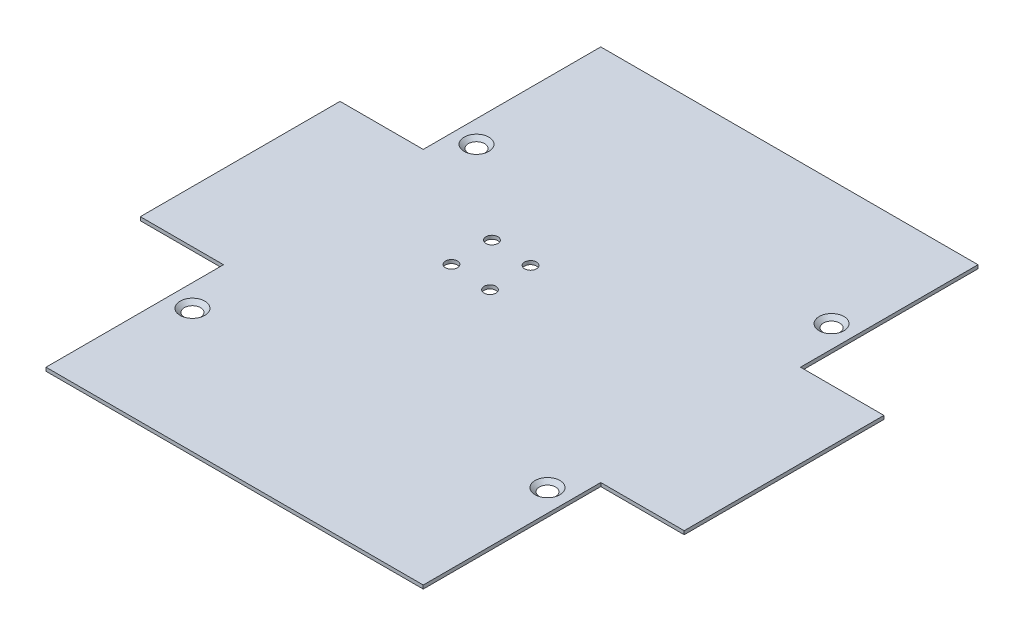
from build123d import *

# Parameters (mm, degrees)
BOSS_EXTRUDE1_DEPTH                       = 1.016
CSK_FOR_6_FLAT_HEAD_MACHINE_SCREW_2_COUNT = 2
CSK_FOR_6_FLAT_HEAD_MACHINE_SCREW_2_PITCH = 95.461432003
CSK_FOR_6_FLAT_HEAD_MACHINE_SCREW_3_COUNT = 2
CSK_FOR_6_FLAT_HEAD_MACHINE_SCREW_3_PITCH = 121.190211651
CSK_FOR_6_FLAT_HEAD_MACHINE_SCREW_4_COUNT = 2
CSK_FOR_6_FLAT_HEAD_MACHINE_SCREW_4_PITCH = 81.28
M3_CLEARANCE_HOLE1_D                      = 3.4
M3_CLEARANCE_HOLE1_DEPTH                  = 20.066
M3_CLEARANCE_HOLE1_TIP                    = 1.021463052


with BuildPart() as part:
    # Sketch1 → Boss-Extrude1 (new body)
    with BuildSketch(Plane(origin=(0, 0, 0), x_dir=(1, 0, 0), z_dir=(0, 1, 0))):
        Polygon((-107.95, 50.8), (-131.7625, 50.8), (-131.7625, 107.95), (-107.95, 107.95), (-107.95, 158.75), (0, 158.75), (0, 107.95), (23.876, 107.95), (23.876, 50.8), (0, 50.8), (0, 0), (-107.95, 0), align=None)
    extrude(amount=BOSS_EXTRUDE1_DEPTH)

    # Sketch2 → CSK for #6 Flat Head Machine Screw (100)1 (revolve, cut)
    with BuildSketch(Plane(origin=(-101.6, 1.016, -116.84), x_dir=(0, 0, 1), z_dir=(1, 0, 0))):
        Polygon((0, 0), (0, 1.016), (1.89865, 1.016), (1.89865, 1.380025208), (3.5433, 0), align=None)
    csk_for_6_flat_head_machine_screw_100 = revolve(axis=Axis((-101.6, 7.366, -116.84), (0, -1, 0)), mode=Mode.SUBTRACT)

    # CSK for _6 Flat Head Machine Screw _ 2: CSK for #6 Flat Head Machine Screw (100)1 ×2
    with Locations(*[Vector(0.997785157856609, 0, -0.06651901052377401) * (i * CSK_FOR_6_FLAT_HEAD_MACHINE_SCREW_2_PITCH) for i in range(1, CSK_FOR_6_FLAT_HEAD_MACHINE_SCREW_2_COUNT)]):
        add(csk_for_6_flat_head_machine_screw_100, mode=Mode.SUBTRACT)

    # CSK for _6 Flat Head Machine Screw _ 3: CSK for #6 Flat Head Machine Screw (100)1 ×2
    with Locations(*[Vector(0.7859545643367972, 0, 0.6182842572782808) * (i * CSK_FOR_6_FLAT_HEAD_MACHINE_SCREW_3_PITCH) for i in range(1, CSK_FOR_6_FLAT_HEAD_MACHINE_SCREW_3_COUNT)]):
        add(csk_for_6_flat_head_machine_screw_100, mode=Mode.SUBTRACT)

    # CSK for _6 Flat Head Machine Screw _ 4: CSK for #6 Flat Head Machine Screw (100)1 ×2
    with Locations(*[(0, 0, i * CSK_FOR_6_FLAT_HEAD_MACHINE_SCREW_4_PITCH) for i in range(1, CSK_FOR_6_FLAT_HEAD_MACHINE_SCREW_4_COUNT)]):
        add(csk_for_6_flat_head_machine_screw_100, mode=Mode.SUBTRACT)

    # M3 Clearance Hole1
    with Locations(Plane(origin=(0, 1.016, 0), x_dir=(1, 0, 0), z_dir=(0, 1, 0))):
        with Locations((-63.846986831, 94.548500407), (-63.621171585, 82.731605313), (-75.641328415, 95.312377887), (-75.415513169, 83.495482793)):
            Hole(M3_CLEARANCE_HOLE1_D / 2, depth=M3_CLEARANCE_HOLE1_DEPTH)
            with Locations((0, 0, -(M3_CLEARANCE_HOLE1_DEPTH + M3_CLEARANCE_HOLE1_TIP / 2))):  # 118° drill point
                Cone(0, M3_CLEARANCE_HOLE1_D / 2, M3_CLEARANCE_HOLE1_TIP, mode=Mode.SUBTRACT)


solid = part.part
